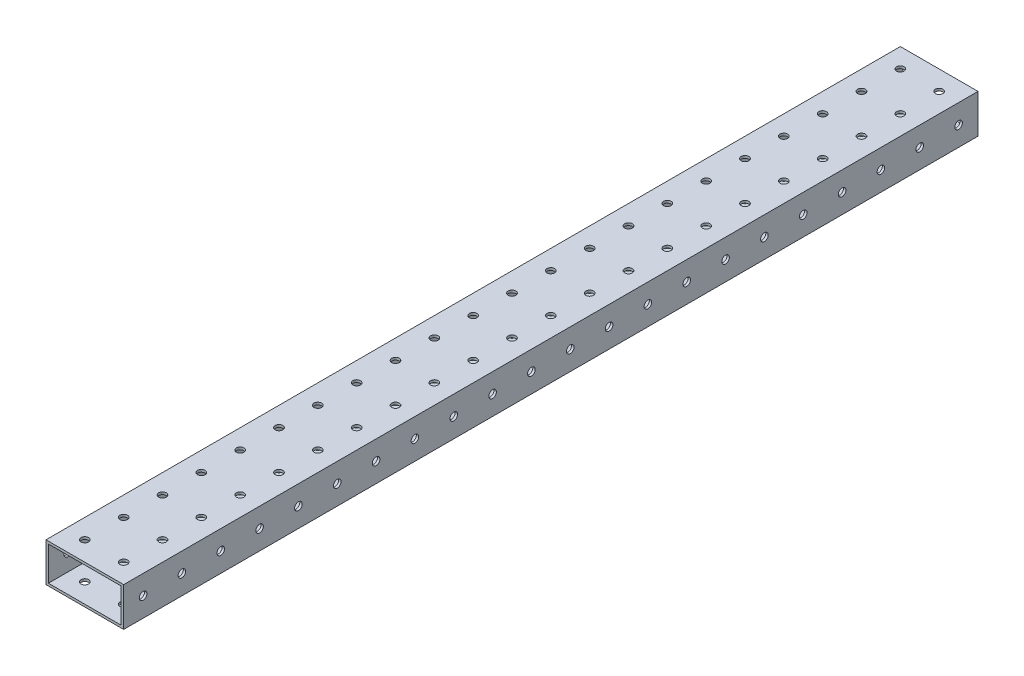
from build123d import *

# Parameters (mm, degrees)
SKETCH1_W            = 50.8
SKETCH1_H            = 25.4
BOSS_EXTRUDE1_DEPTH  = 279.4
SHELL1_T             = -1.5875
SKETCH2_R            = 2.4892
CUT_EXTRUDE1_DEPTH   = 286.114292872
LPATTERN1_COUNT      = 2
LPATTERN1_PITCH      = 25.4
LPATTERN1_COUNT_DIR2 = 22
LPATTERN1_PITCH_DIR2 = 25.4
SKETCH3_R            = 2.4892
CUT_EXTRUDE2_DEPTH   = 286.114292872
LPATTERN2_COUNT      = 22
LPATTERN2_PITCH      = 25.4


with BuildPart() as part:
    # Sketch1 → Boss-Extrude1 (new, symmetric)
    with BuildSketch(Plane.XY):
        with Locations((25.4, 12.7)):
            Rectangle(SKETCH1_W, SKETCH1_H)
    extrude(amount=BOSS_EXTRUDE1_DEPTH, both=True)

    # Shell1
    shell1_openings = [part.faces().sort_by_distance(p)[0] for p in [
        (25.4, 12.7, 279.4),
        (25.4, 12.7, -279.4),
    ]]
    offset(amount=SHELL1_T, openings=shell1_openings, kind=Kind.INTERSECTION)

    # Sketch2 → Cut-Extrude1 (cut, through all)
    with BuildSketch(Plane.XZ):
        with Locations(Location((12.7, 266.7, 0), (0, 0, 270))):
            Circle(SKETCH2_R)
    cut_extrude1 = extrude(amount=-CUT_EXTRUDE1_DEPTH, mode=Mode.SUBTRACT)

    # LPattern1: Cut-Extrude1 2 × 22
    with Locations(*[(i * LPATTERN1_PITCH, 0, -j * LPATTERN1_PITCH_DIR2) for i in range(LPATTERN1_COUNT) for j in range(LPATTERN1_COUNT_DIR2) if (i, j) != (0, 0)]):
        add(cut_extrude1, mode=Mode.SUBTRACT)

    # Sketch3 → Cut-Extrude2 (cut, through all)
    with BuildSketch(Plane.ZY):
        with Locations((-266.7, 12.7)):
            Circle(SKETCH3_R)
    cut_extrude2 = extrude(amount=-CUT_EXTRUDE2_DEPTH, mode=Mode.SUBTRACT)

    # LPattern2: Cut-Extrude2 ×22
    with Locations(*[(0, 0, i * LPATTERN2_PITCH) for i in range(1, LPATTERN2_COUNT)]):
        add(cut_extrude2, mode=Mode.SUBTRACT)


solid = part.part
